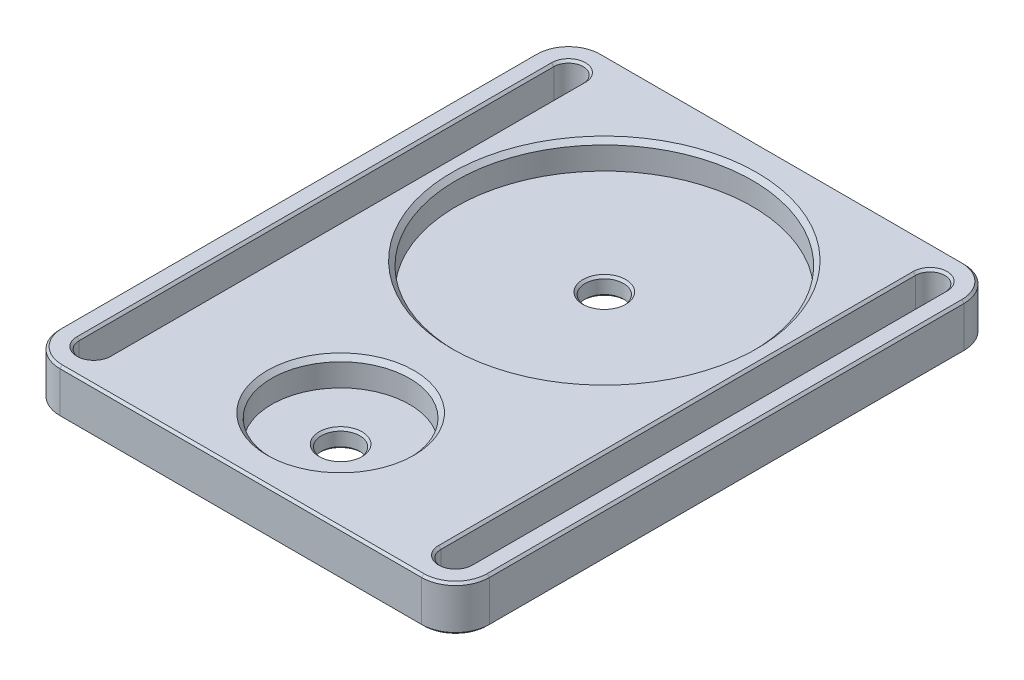
from build123d import *

# Parameters (mm, degrees)
SKETCH1_R           = 32.75
SKETCH1_R_2         = 15.25
SKETCH1_R_3         = 4.25
BOSS_EXTRUDE1_DEPTH = 10
SKETCH1_4_R         = 4.25
CUT_EXTRUDE2_DEPTH  = 94.934159921
CUT_EXTRUDE3_START  = 4
SKETCH1_6_R         = 32.75
SKETCH1_6_R_2       = 4.25
SKETCH1_6_R_3       = 15.25
CUT_EXTRUDE3_DEPTH  = 90.934159921
CHAMFER1_SIZE       = 1
CHAMFER2_SIZE       = 0.5


with BuildPart() as part:
    # Sketch1 → Boss-Extrude1 (new body)
    # profile 1 of 9: a face of its own
    with BuildSketch(Plane(origin=(0, 0, 0), x_dir=(1, 0, 0), z_dir=(0, 1, 0))):
        with BuildLine():
            Line((-40, -80.42), (40, -80.42))
            ThreePointArc((40, -80.42), (45.303300859, -78.223300859), (47.5, -72.92))
            Line((47.5, -72.92), (47.5, 32.08))
            ThreePointArc((47.5, 32.08), (45.303300859, 37.383300859), (40, 39.58))
            Line((40, 39.58), (-40, 39.58))
            ThreePointArc((-40, 39.58), (-45.303300859, 37.383300859), (-47.5, 32.08))
            Line((-47.5, 32.08), (-47.5, -72.92))
            ThreePointArc((-47.5, -72.92), (-45.303300859, -78.223300859), (-40, -80.42))
        make_face()
        Circle(SKETCH1_R, mode=Mode.SUBTRACT)
        with Locations((0, -58.34)):
            Circle(SKETCH1_R_2, mode=Mode.SUBTRACT)
        with BuildLine():
            ThreePointArc((46, 32.08), (40, 38.08), (34, 32.08))
            Line((34, 32.08), (34, -72.92))
            ThreePointArc((34, -72.92), (40, -78.92), (46, -72.92))
            Line((46, -72.92), (46, 32.08))
        make_face(mode=Mode.SUBTRACT)
        with BuildLine():
            ThreePointArc((-34, 32.08), (-40, 38.08), (-46, 32.08))
            Line((-46, 32.08), (-46, -72.92))
            ThreePointArc((-46, -72.92), (-40, -78.92), (-34, -72.92))
            Line((-34, -72.92), (-34, 32.08))
        make_face(mode=Mode.SUBTRACT)
    # profile 2 of 9: a face of its own
    with BuildSketch(Plane(origin=(0, 0, 0), x_dir=(1, 0, 0), z_dir=(0, 1, 0))):
        Circle(SKETCH1_R)
        Circle(SKETCH1_R_3, mode=Mode.SUBTRACT)
    # profile 3 of 9: a face of its own
    with BuildSketch(Plane(origin=(0, 0, 0), x_dir=(1, 0, 0), z_dir=(0, 1, 0))):
        with Locations((0, -58.34)):
            Circle(SKETCH1_R_2)
        with Locations((0, -58.34)):
            Circle(SKETCH1_R_3, mode=Mode.SUBTRACT)
    # profile 4 of 9: a face of its own
    with BuildSketch(Plane(origin=(0, 0, 0), x_dir=(1, 0, 0), z_dir=(0, 1, 0))):
        with BuildLine():
            Line((-34, -72.92), (-34, 32.08))
            ThreePointArc((-34, 32.08), (-40, 38.08), (-46, 32.08))
            Line((-46, 32.08), (-46, -72.92))
            ThreePointArc((-46, -72.92), (-40, -78.92), (-34, -72.92))
        make_face()
        with BuildLine():
            ThreePointArc((-43.25, -72.92), (-40, -76.17), (-36.75, -72.92))
            Line((-36.75, -72.92), (-36.75, 32.08))
            ThreePointArc((-36.75, 32.08), (-40, 35.33), (-43.25, 32.08))
            Line((-43.25, 32.08), (-43.25, -72.92))
        make_face(mode=Mode.SUBTRACT)
    # profile 5 of 9: a face of its own
    with BuildSketch(Plane(origin=(0, 0, 0), x_dir=(1, 0, 0), z_dir=(0, 1, 0))):
        with BuildLine():
            Line((46, -72.92), (46, 32.08))
            ThreePointArc((46, 32.08), (40, 38.08), (34, 32.08))
            Line((34, 32.08), (34, -72.92))
            ThreePointArc((34, -72.92), (40, -78.92), (46, -72.92))
        make_face()
        with BuildLine():
            ThreePointArc((36.75, -72.92), (40, -76.17), (43.25, -72.92))
            Line((43.25, -72.92), (43.25, 32.08))
            ThreePointArc((43.25, 32.08), (40, 35.33), (36.75, 32.08))
            Line((36.75, 32.08), (36.75, -72.92))
        make_face(mode=Mode.SUBTRACT)
    # profile 6 of 9: a face of its own
    with BuildSketch(Plane(origin=(0, 0, 0), x_dir=(1, 0, 0), z_dir=(0, 1, 0))):
        with BuildLine():
            Line((36.75, 32.08), (36.75, -72.92))
            ThreePointArc((36.75, -72.92), (40, -76.17), (43.25, -72.92))
            Line((43.25, -72.92), (43.25, 32.08))
            ThreePointArc((43.25, 32.08), (40, 35.33), (36.75, 32.08))
        make_face()
    # profile 7 of 9: a face of its own
    with BuildSketch(Plane(origin=(0, 0, 0), x_dir=(1, 0, 0), z_dir=(0, 1, 0))):
        with BuildLine():
            Line((-43.25, 32.08), (-43.25, -72.92))
            ThreePointArc((-43.25, -72.92), (-40, -76.17), (-36.75, -72.92))
            Line((-36.75, -72.92), (-36.75, 32.08))
            ThreePointArc((-36.75, 32.08), (-40, 35.33), (-43.25, 32.08))
        make_face()
    # profile 8 of 9: a face of its own
    with BuildSketch(Plane(origin=(0, 0, 0), x_dir=(1, 0, 0), z_dir=(0, 1, 0))):
        Circle(SKETCH1_R_3)
    # profile 9 of 9: a face of its own
    with BuildSketch(Plane(origin=(0, 0, 0), x_dir=(1, 0, 0), z_dir=(0, 1, 0))):
        with Locations((0, -58.34)):
            Circle(SKETCH1_R_3)
    extrude(amount=BOSS_EXTRUDE1_DEPTH)

    # Sketch1<4> → Cut-Extrude2 (cut, through all)
    with BuildSketch(Plane(origin=(0, 0, 0), x_dir=(1, 0, 0), z_dir=(0, 1, 0))):
        with BuildLine():
            Line((36.75, 32.08), (36.75, -72.92))
            ThreePointArc((36.75, -72.92), (40, -76.17), (43.25, -72.92))
            Line((43.25, -72.92), (43.25, 32.08))
            ThreePointArc((43.25, 32.08), (40, 35.33), (36.75, 32.08))
        make_face()
        with Locations(Location((0, 0, 0), (0, 0, 270))):
            Circle(SKETCH1_4_R)
        with Locations(Location((0, -58.34, 0), (0, 0, 270))):
            Circle(SKETCH1_4_R)
        with BuildLine():
            Line((-43.25, 32.08), (-43.25, -72.92))
            ThreePointArc((-43.25, -72.92), (-40, -76.17), (-36.75, -72.92))
            Line((-36.75, -72.92), (-36.75, 32.08))
            ThreePointArc((-36.75, 32.08), (-40, 35.33), (-43.25, 32.08))
        make_face()
    extrude(amount=CUT_EXTRUDE2_DEPTH, mode=Mode.SUBTRACT)

    # Sketch1<6> → Cut-Extrude3 (cut, through all)
    # profile 1 of 2: a face of its own
    with BuildSketch(Plane(origin=(0, 0, 0), x_dir=(1, 0, 0), z_dir=(0, 1, 0)).offset(CUT_EXTRUDE3_START)):
        with Locations(Location((0, 0, 0), (0, 0, 270))):
            Circle(SKETCH1_6_R)
        with Locations(Location((0, 0, 0), (0, 0, 270))):
            Circle(SKETCH1_6_R_2, mode=Mode.SUBTRACT)
    # profile 2 of 2: a face of its own
    with BuildSketch(Plane(origin=(0, 0, 0), x_dir=(1, 0, 0), z_dir=(0, 1, 0)).offset(CUT_EXTRUDE3_START)):
        with Locations(Location((0, -58.34, 0), (0, 0, 270))):
            Circle(SKETCH1_6_R_3)
        with Locations(Location((0, -58.34, 0), (0, 0, 270))):
            Circle(SKETCH1_6_R_2, mode=Mode.SUBTRACT)
    extrude(amount=CUT_EXTRUDE3_DEPTH, mode=Mode.SUBTRACT)

    # Chamfer1
    chamfer1_edges = [part.edges().sort_by_distance(p)[0] for p in [
        (0, 10, -32.75),
        (0, 10, 43.09),
    ]]
    chamfer(chamfer1_edges, length=CHAMFER1_SIZE)

    # Chamfer2
    chamfer2_edges = [part.edges().sort_by_distance(p)[0] for p in [
        (45.303300859, 10, 78.223300859),
        (-47.5, 0, 20.42),
        (-45.303300859, 0, -37.383300859),
        (0, 0, -39.58),
        (45.303300859, 0, -37.383300859),
        (47.5, 0, 20.42),
        (45.303300859, 0, 78.223300859),
        (0, 0, 80.42),
        (47.5, 10, 20.42),
        (45.303300859, 10, -37.383300859),
        (0, 10, -39.58),
        (-45.303300859, 10, -37.383300859),
        (-47.5, 10, 20.42),
        (36.75, 0, 20.42),
        (40, 0, 76.17),
        (43.25, 10, 20.42),
        (40, 0, -35.33),
        (36.75, 10, 20.42),
        (-45.303300859, 10, 78.223300859),
        (40, 10, 76.17),
        (40, 10, -35.33),
        (43.25, 0, 20.42),
        (0, 0, -4.25),
        (0, 0, 54.09),
        (-43.25, 0, 20.42),
        (-40, 0, 76.17),
        (-36.75, 10, 20.42),
        (-40, 0, -35.33),
        (-43.25, 10, 20.42),
        (-40, 10, 76.17),
        (-40, 10, -35.33),
        (0, 10, 80.42),
        (-36.75, 0, 20.42),
        (0, 4, -4.25),
        (0, 4, 54.09),
        (-45.303300859, 0, 78.223300859),
    ]]
    chamfer(chamfer2_edges, length=CHAMFER2_SIZE)


solid = part.part
